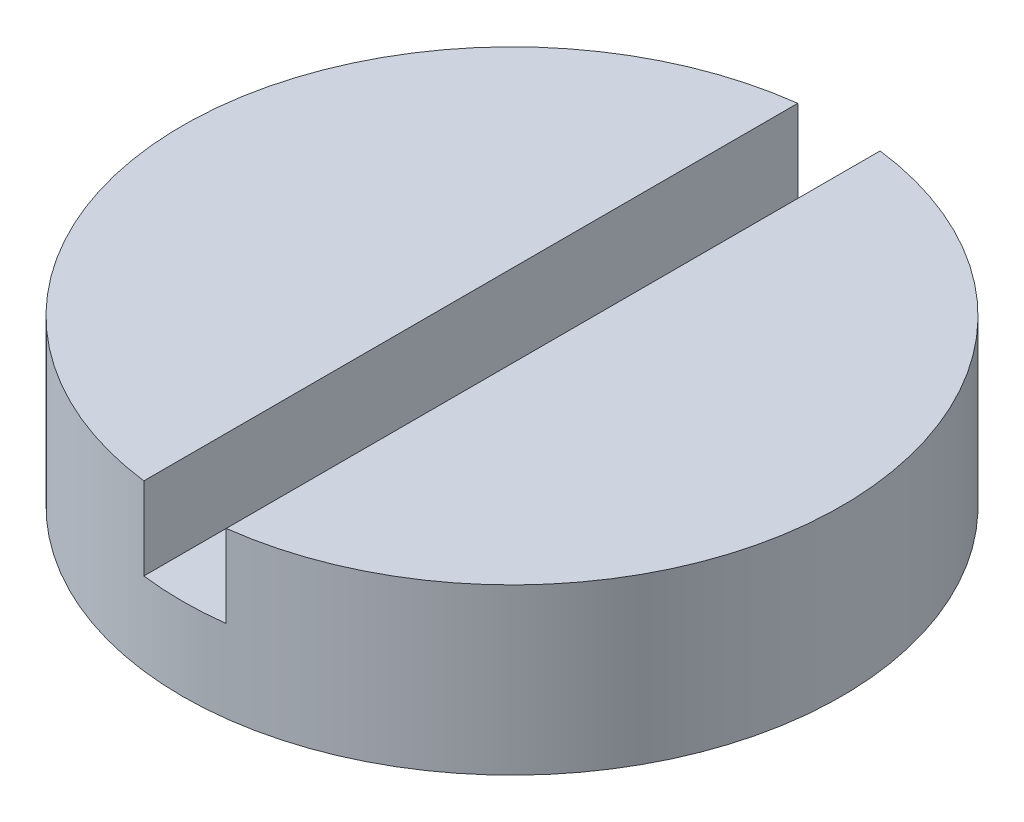
from build123d import *

# Parameters (mm, degrees)
CROQUIS1_R              = 4
SALIENTE_EXTRUIR1_DEPTH = 2
CORTAR_EXTRUIR1_START   = -1
CORTAR_EXTRUIR1_DEPTH   = 1


with BuildPart() as part:
    # Croquis1 → Saliente-Extruir1 (new body)
    with BuildSketch(Plane(origin=(0, 0, 0), x_dir=(1, 0, 0), z_dir=(0, 1, 0))):
        with Locations(Location((0, 0, 0), (0, 0, 270))):
            Circle(CROQUIS1_R)
    extrude(amount=SALIENTE_EXTRUIR1_DEPTH)

    # Croquis2 → Cortar-Extruir1 (cut)
    with BuildSketch(Plane(origin=(0, 2, 0), x_dir=(1, 0, 0), z_dir=(0, 1, 0)).offset(CORTAR_EXTRUIR1_START)):
        with BuildLine():
            Line((-0.5, 3.968626967), (-0.5, -3.968626967))
            ThreePointArc((-0.5, -3.968626967), (0, -4), (0.5, -3.968626967))
            Line((0.5, -3.968626967), (0.5, 3.968626967))
            ThreePointArc((0.5, 3.968626967), (0, 4), (-0.5, 3.968626967))
        make_face()
    extrude(amount=CORTAR_EXTRUIR1_DEPTH, mode=Mode.SUBTRACT)


solid = part.part
